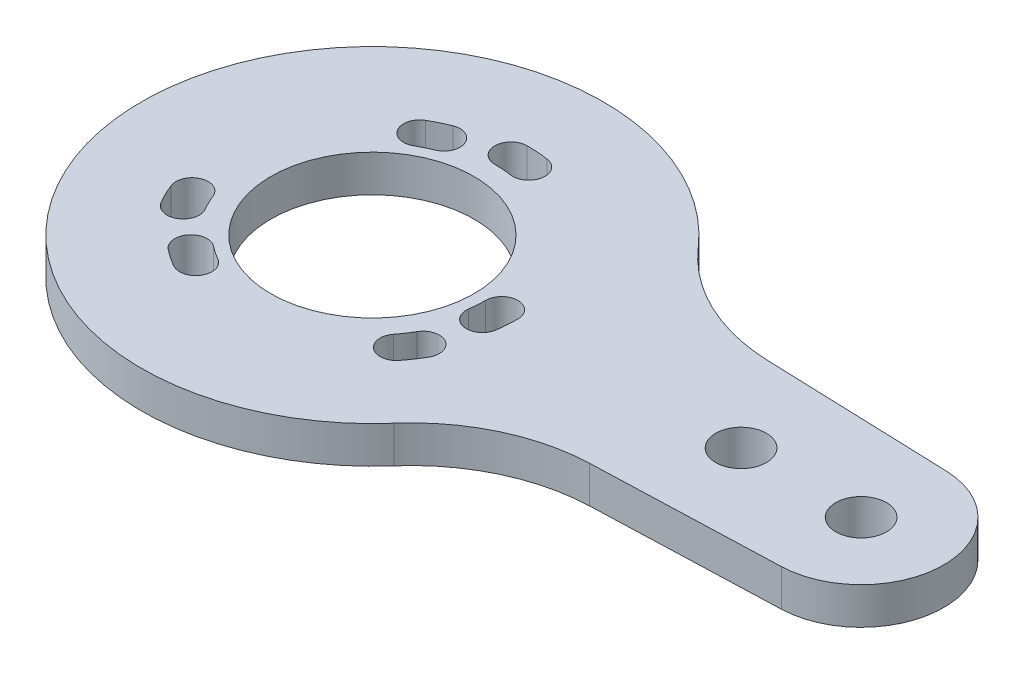
from build123d import *

# Parameters (mm, degrees)
BOSS_EXTRUDE1_DEPTH = 4
FILLET1_R           = 20
SKETCH1_R           = 11
SKETCH1_R_2         = 2.75
CUT_EXTRUDE3_DEPTH  = 131.855321132


with BuildPart() as part:
    # Sketch3 → Boss-Extrude1 (new body)
    with BuildSketch(Plane(origin=(0, 0, 0), x_dir=(1, 0, 0), z_dir=(0, 1, 0))):
        with BuildLine():
            Line((22.912878475, 10), (53.225121597, 8.941473145))
            ThreePointArc((53.225121597, 8.941473145), (61.859801844, 0), (53.225121597, -8.941473145))
            Line((53.225121597, -8.941473145), (22.912878475, -10))
            ThreePointArc((22.912878475, -10), (-25, 0), (22.912878475, 10))
        make_face()
    extrude(amount=BOSS_EXTRUDE1_DEPTH)

    # Fillet1
    fillet1_edges = [part.edges().sort_by_distance(p)[0] for p in [
        (22.912878475, 2, -10),
        (22.912878475, 2, 10),
    ]]
    fillet(fillet1_edges, radius=FILLET1_R)

    # Sketch1 → Cut-Extrude3 (cut, through all)
    with BuildSketch(Plane(origin=(103.38268991, 0, 0), x_dir=(1, 0, 0), z_dir=(0, 1, 0))):
        with Locations(Location((-103.38268991, 0, 0), (0, 0, 270))):
            Circle(SKETCH1_R)
        with Locations(Location((-63.469811435, 0, 0), (0, 0, 90))):
            Circle(SKETCH1_R_2)
        with Locations(Location((-50.469811435, 0, 0), (0, 0, 90))):
            Circle(SKETCH1_R_2)
        with BuildLine():
            ThreePointArc((-111.25768991, 13.63990011), (-110.287035472, 14.156006229), (-109.282743756, 14.603145709))
            ThreePointArc((-109.282743756, 14.603145709), (-107.004610472, 13.636135502), (-107.971620679, 11.358002218))
            ThreePointArc((-107.971620679, 11.358002218), (-108.752736458, 11.010227067), (-109.50768991, 10.608811196))
            ThreePointArc((-109.50768991, 10.608811196), (-111.898234366, 11.249355653), (-111.25768991, 13.63990011))
        make_face()
        with BuildLine():
            ThreePointArc((-101.538646322, 13.121051911), (-102.458416633, 13.217723666), (-103.38268991, 13.25))
            ThreePointArc((-103.38268991, 13.25), (-105.13268991, 15), (-103.38268991, 16.75))
            ThreePointArc((-103.38268991, 16.75), (-102.214268974, 16.709197842), (-101.051540469, 16.586990151))
            ThreePointArc((-101.051540469, 16.586990151), (-99.562124275, 14.610468104), (-101.538646322, 13.121051911))
        make_face()
        with BuildLine():
            ThreePointArc((-87.63268991, 0), (-89.38268991, 1.75), (-91.13268991, 0))
            ThreePointArc((-91.13268991, 0), (-91.162530294, -0.854516803), (-91.251906068, -1.704870487))
            ThreePointArc((-91.251906068, -1.704870487), (-89.762489874, -3.681392534), (-87.785967827, -2.19197634))
            ThreePointArc((-87.785967827, -2.19197634), (-87.671056118, -1.098664461), (-87.63268991, 0))
        make_face()
        with BuildLine():
            ThreePointArc((-92.941547424, -8.157514548), (-92.639936187, -10.613940949), (-90.183509787, -10.312329712))
            ThreePointArc((-90.183509787, -10.312329712), (-89.496310569, -9.366481133), (-88.876764396, -8.375))
            ThreePointArc((-88.876764396, -8.375), (-89.517308853, -5.984455543), (-91.90785331, -6.625))
            ThreePointArc((-91.90785331, -6.625), (-92.397942073, -7.409305971), (-92.941547424, -8.157514548))
        make_face()
        with BuildLine():
            ThreePointArc((-111.25768991, -13.63990011), (-108.867145453, -12.999355653), (-109.50768991, -10.608811196))
            ThreePointArc((-109.50768991, -10.608811196), (-110.232802977, -10.155710264), (-110.924542982, -9.653131732))
            ThreePointArc((-110.924542982, -9.653131732), (-113.380969383, -9.954742969), (-113.079358146, -12.411169369))
            ThreePointArc((-113.079358146, -12.411169369), (-112.189978139, -13.057341768), (-111.25768991, -13.63990011))
        make_face()
        with BuildLine():
            ThreePointArc((-115.667875983, -4.963537363), (-117.946009267, -3.996527156), (-118.913019474, -6.27466044))
            ThreePointArc((-118.913019474, -6.27466044), (-118.437490185, -7.342716709), (-117.888615423, -8.375))
            ThreePointArc((-117.888615423, -8.375), (-115.498070966, -9.015544457), (-114.85752651, -6.625))
            ThreePointArc((-114.85752651, -6.625), (-115.291711023, -5.808417695), (-115.667875983, -4.963537363))
        make_face()
    extrude(amount=CUT_EXTRUDE3_DEPTH, mode=Mode.SUBTRACT)


solid = part.part
